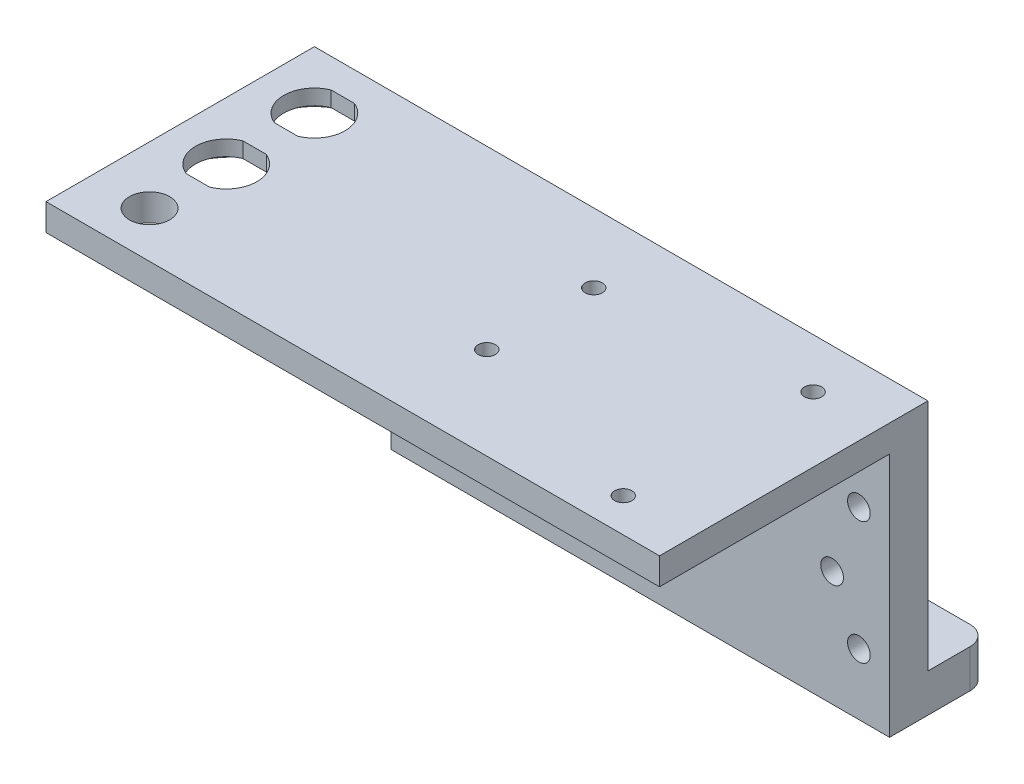
from build123d import *

# Parameters (mm, degrees)
SKETCH1_W           = 130
SKETCH1_H           = 64
SKETCH1_R           = 2.9575
BOSS_EXTRUDE1_DEPTH = 10
SKETCH2_W           = 130
SKETCH2_H           = 16
SKETCH2_R           = 2.75
BOSS_EXTRUDE2_DEPTH = 10
SKETCH3_W           = 160
SKETCH3_H           = 70
SKETCH3_R           = 2.25
SKETCH3_R_2         = 5.25
BOSS_EXTRUDE3_DEPTH = 7
SKETCH4_R           = 12
CUT_EXTRUDE1_DEPTH  = 3
FILLET1_R           = 5
CUT_EXTRUDE2_REACH  = 126.282
SKETCH5_R           = 2.9575
FILLET2_R           = 5
FILLET3_R           = 5


with BuildPart() as part:
    # Sketch1 → Boss-Extrude1 (new body)
    with BuildSketch(Plane.XY):
        Rectangle(SKETCH1_W, SKETCH1_H)
        with Locations((57, 16)):
            Circle(SKETCH1_R, mode=Mode.SUBTRACT)
        with Locations((57, -16)):
            Circle(SKETCH1_R, mode=Mode.SUBTRACT)
        with Locations((-57, -16)):
            Circle(SKETCH1_R, mode=Mode.SUBTRACT)
        with Locations((-57, 16)):
            Circle(SKETCH1_R, mode=Mode.SUBTRACT)
    extrude(amount=BOSS_EXTRUDE1_DEPTH)

    # Sketch2 → Boss-Extrude2 (add)
    with BuildSketch(Plane.XZ.offset(32)):
        with Locations((0, -8)):
            Rectangle(SKETCH2_W, SKETCH2_H)
        with Locations(Location((-40, -9, 0), (0, 0, 270))):
            Circle(SKETCH2_R, mode=Mode.SUBTRACT)
        with Locations(Location((40, -9, 0), (0, 0, 90))):
            Circle(SKETCH2_R, mode=Mode.SUBTRACT)
    extrude(amount=-BOSS_EXTRUDE2_DEPTH)

    # Sketch3 → Boss-Extrude3 (add)
    with BuildSketch(Plane(origin=(0, 32, 0), x_dir=(1, 0, 0), z_dir=(0, 1, 0))):
        with Locations((-15, -35)):
            Rectangle(SKETCH3_W, SKETCH3_H)
        with Locations(Location((48, -12.95, 0), (0, 0, 270))):
            Circle(SKETCH3_R, mode=Mode.SUBTRACT)
        with Locations(Location((-4.1, -18.05, 0), (0, 0, 270))):
            Circle(SKETCH3_R, mode=Mode.SUBTRACT)
        with Locations(Location((-4.1, -45.95, 0), (0, 0, 270))):
            Circle(SKETCH3_R, mode=Mode.SUBTRACT)
        with Locations(Location((46.7, -61.15, 0), (0, 0, 270))):
            Circle(SKETCH3_R, mode=Mode.SUBTRACT)
        with Locations(Location((-80, -58, 0), (0, 0, 270))):
            Circle(SKETCH3_R_2, mode=Mode.SUBTRACT)
        with BuildLine():
            Line((-83.039736831, -30.6), (-76.960263169, -30.6))
            ThreePointArc((-76.960263169, -30.6), (-72, -38), (-76.960263169, -45.4))
            Line((-76.960263169, -45.4), (-83.039736831, -45.4))
            ThreePointArc((-83.039736831, -45.4), (-88, -38), (-83.039736831, -30.6))
        make_face(mode=Mode.SUBTRACT)
        with BuildLine():
            Line((-83.039736831, -7.6), (-76.960263169, -7.6))
            ThreePointArc((-76.960263169, -7.6), (-72, -15), (-76.960263169, -22.4))
            Line((-76.960263169, -22.4), (-83.039736831, -22.4))
            ThreePointArc((-83.039736831, -22.4), (-88, -15), (-83.039736831, -7.6))
        make_face(mode=Mode.SUBTRACT)
    extrude(amount=BOSS_EXTRUDE3_DEPTH)

    # Sketch4 → Cut-Extrude1 (cut)
    # profile 1 of 6: a face of its own
    with BuildSketch(Plane.XZ.offset(-32)):
        with Locations((-80, 38)):
            Circle(SKETCH4_R)
    # profile 2 of 6: a face of its own
    with BuildSketch(Plane.XZ.offset(-32)):
        with Locations((-80, 15)):
            Circle(SKETCH4_R)
        with BuildLine():
            Line((-76.960263169, 7.6), (-83.039736831, 7.6))
            ThreePointArc((-83.039736831, 7.6), (-88, 15), (-83.039736831, 22.4))
            Line((-83.039736831, 22.4), (-76.960263169, 22.4))
            ThreePointArc((-76.960263169, 22.4), (-72, 15), (-76.960263169, 7.6))
        make_face(mode=Mode.SUBTRACT)
    # profile 3 of 6: a face of its own
    with BuildSketch(Plane.XZ.offset(-32)):
        with Locations((-80, 15)):
            Circle(SKETCH4_R)
    # profile 4 of 6: a face of its own
    with BuildSketch(Plane.XZ.offset(-32)):
        with Locations((-80, 38)):
            Circle(SKETCH4_R)
        with BuildLine():
            Line((-76.960263169, 30.6), (-83.039736831, 30.6))
            ThreePointArc((-83.039736831, 30.6), (-88, 38), (-83.039736831, 45.4))
            Line((-83.039736831, 45.4), (-76.960263169, 45.4))
            ThreePointArc((-76.960263169, 45.4), (-72, 38), (-76.960263169, 30.6))
        make_face(mode=Mode.SUBTRACT)
    # profile 5 of 6: a face of its own
    with BuildSketch(Plane.XZ.offset(-32)):
        with Locations((-80, 38)):
            Circle(SKETCH4_R)
    # profile 6 of 6: a face of its own
    with BuildSketch(Plane.XZ.offset(-32)):
        with Locations((-80, 15)):
            Circle(SKETCH4_R)
    extrude(amount=-CUT_EXTRUDE1_DEPTH, mode=Mode.SUBTRACT)

    # Fillet1
    fillet1_edges = [part.edges().sort_by_distance(p)[0] for p in [
        (-83.4278273, 33.5, 26.5),
        (-76.5721727, 33.5, 26.5),
    ]]
    fillet(fillet1_edges, radius=FILLET1_R)

    # Sketch5 → Cut-Extrude2 (cut, up to next)
    with BuildSketch(Plane(origin=(0, 0, 0), x_dir=(-1, 0, 0), z_dir=(0, 0, -1)), mode=Mode.PRIVATE) as cut_extrude2_sk1:
        with Locations((-50, -2)):
            Circle(SKETCH5_R)
    cut_extrude2_tool1 = extrude(cut_extrude2_sk1.sketch, amount=-CUT_EXTRUDE2_REACH, mode=Mode.PRIVATE) & part.part
    # Sketch5 → Cut-Extrude2 (cut, up to next)
    with BuildSketch(Plane(origin=(0, 0, 0), x_dir=(-1, 0, 0), z_dir=(0, 0, -1)), mode=Mode.PRIVATE) as cut_extrude2_sk2:
        with Locations((50, -2)):
            Circle(SKETCH5_R)
    cut_extrude2_tool2 = extrude(cut_extrude2_sk2.sketch, amount=-CUT_EXTRUDE2_REACH, mode=Mode.PRIVATE) & part.part
    add(cut_extrude2_tool1.solids().sort_by_distance((50, -2, 0))[0], mode=Mode.SUBTRACT)
    add(cut_extrude2_tool2.solids().sort_by_distance((-50, -2, 0))[0], mode=Mode.SUBTRACT)

    # Fillet2
    fillet2_edges = [part.edges().sort_by_distance(p)[0] for p in [
        (-65, -27, -16),
    ]]
    fillet(fillet2_edges, radius=FILLET2_R)

    # Fillet3
    fillet3_edges = [part.edges().sort_by_distance(p)[0] for p in [
        (65, -27, -16),
    ]]
    fillet(fillet3_edges, radius=FILLET3_R)


solid = part.part
